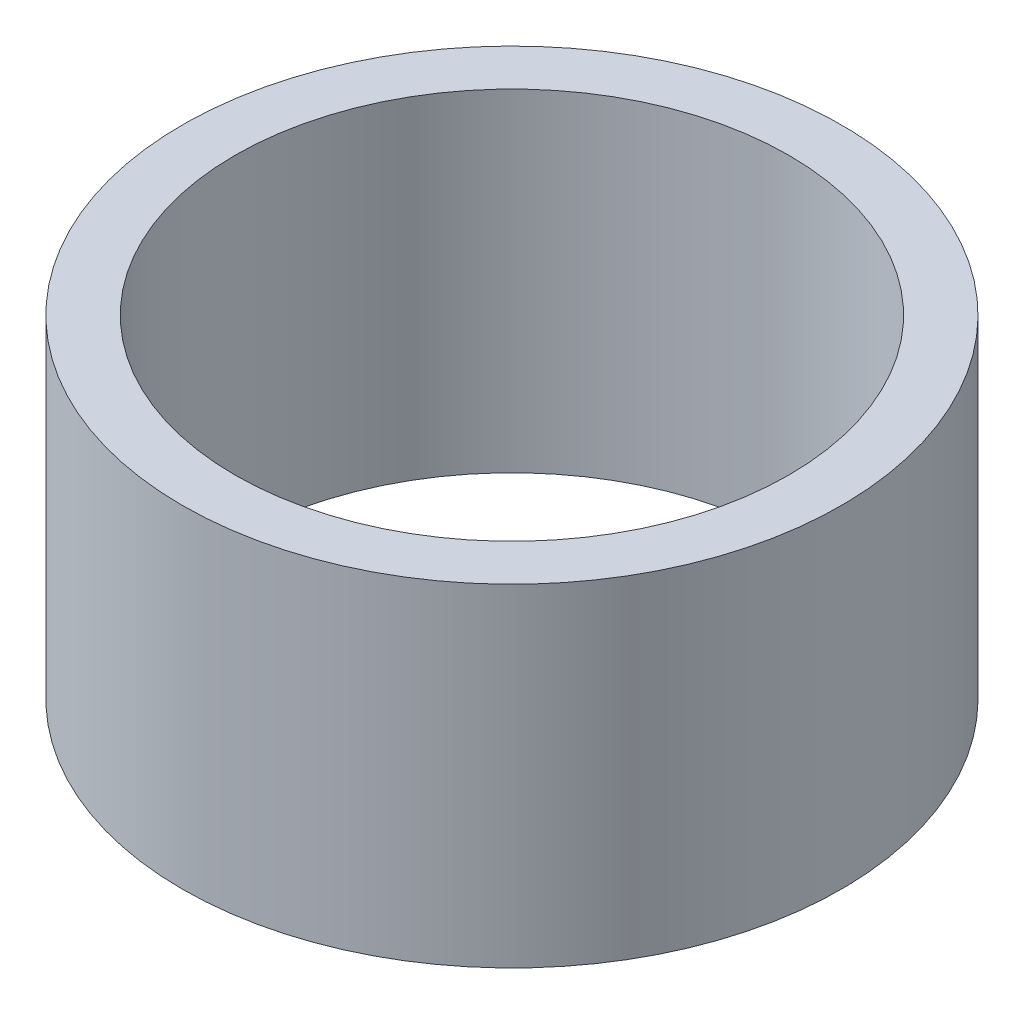
from build123d import *

# Parameters (mm, degrees)
SKETCH1_R           = 75.565
SKETCH1_R_2         = 63.5
BOSS_EXTRUDE1_DEPTH = 76.2


with BuildPart() as part:
    # Sketch1 → Boss-Extrude1 (new body)
    with BuildSketch(Plane(origin=(0, 0, 0), x_dir=(1, 0, 0), z_dir=(0, 1, 0))):
        with Locations(Location((0, 0, 0), (0, 0, 270))):
            Circle(SKETCH1_R)
        with Locations(Location((0, 0, 0), (0, 0, 270))):
            Circle(SKETCH1_R_2, mode=Mode.SUBTRACT)
    extrude(amount=-BOSS_EXTRUDE1_DEPTH)


solid = part.part
